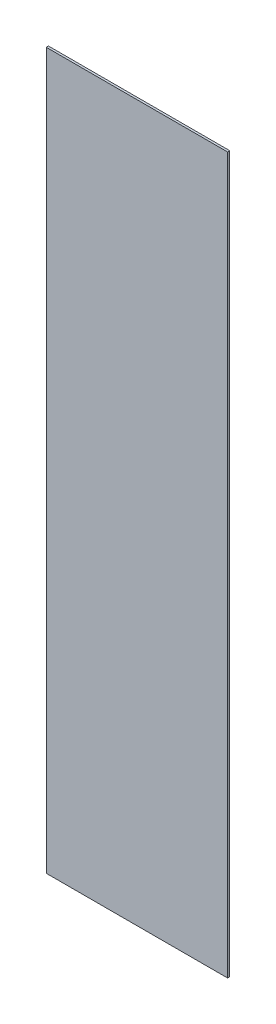
from build123d import *

# Parameters (mm, degrees)
SKETCH1_W           = 83
SKETCH1_H           = 327.5
BOSS_EXTRUDE1_DEPTH = 1


with BuildPart() as part:
    # Sketch1 → Boss-Extrude1 (new body)
    with BuildSketch(Plane.XY):
        with Locations((41.5, 163.75)):
            Rectangle(SKETCH1_W, SKETCH1_H)
    extrude(amount=BOSS_EXTRUDE1_DEPTH)


solid = part.part
